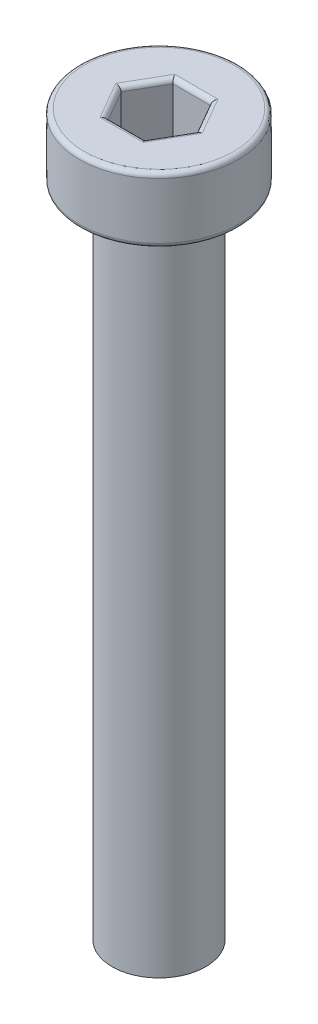
from build123d import *

# Parameters (mm, degrees)
CUT_EXTRUDE1_DEPTH = 3
FILLET1_R          = 0.25


with BuildPart() as part:
    # Sketch2 → Revolve1 (revolve)
    with BuildSketch(Plane.XY, mode=Mode.PRIVATE) as revolve1_sk:
        Polygon((0, 3.5), (4.25, 3.5), (4.25, 0), (2.5, 0), (2.5, -35), (0, -35), align=None)
    revolve(revolve1_sk.sketch.rotate(Axis((0, 21.322324325, 0), (0, -1, 0)), 180), axis=Axis((0, 21.322324325, 0), (0, -1, 0)))

    # Sketch3 → Cut-Extrude1 (cut)
    with BuildSketch(Plane(origin=(0, 3.5, 0), x_dir=(1, 0, 0), z_dir=(0, 1, 0))):
        Polygon((2.020725942, 0), (1.010362971, 1.75), (-1.010362971, 1.75), (-2.020725942, 0), (-1.010362971, -1.75), (1.010362971, -1.75), align=None)
    extrude(amount=-CUT_EXTRUDE1_DEPTH, mode=Mode.SUBTRACT)

    # Fillet1
    fillet1_edges = [part.edges().sort_by_distance(p)[0] for p in [
        (1.515544457, 3.5, 0.875),
        (1.515544457, 3.5, -0.875),
        (0, 3.5, -1.75),
        (-1.515544457, 3.5, -0.875),
        (-1.515544457, 3.5, 0.875),
        (0, 3.5, 1.75),
        (2.5, 0, 0),
        (4.25, 0, 0),
        (4.25, 3.5, 0),
    ]]
    fillet(fillet1_edges, radius=FILLET1_R)


solid = part.part
